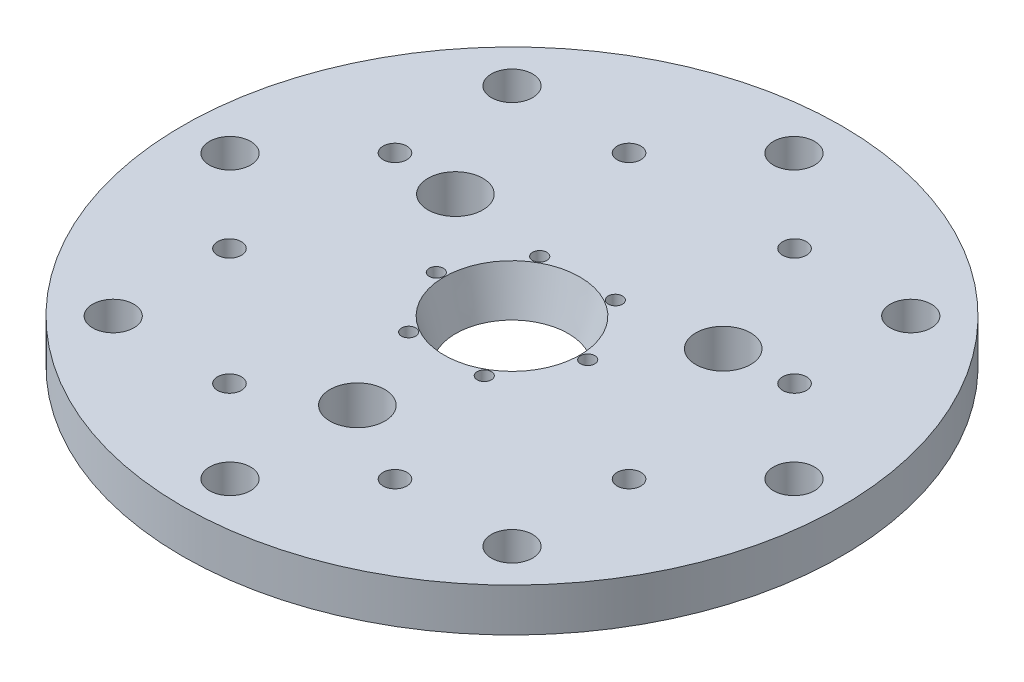
from build123d import *

# Parameters (mm, degrees)
SKETCH1_R                    = 76.2
BOSS_EXTRUDE1_DEPTH          = 10
SKETCH6_R                    = 2.75
CUT_EXTRUDE3_DEPTH           = 109.226059708
CIRPATTERN1_COUNT            = 8
SKETCH7_R                    = 6.35
CUT_EXTRUDE4_DEPTH           = 109.226059708
CIRPATTERN2_COUNT            = 3
F_3_8_0_375_DIAMETER_HOLE1_D = 9.525
CIRPATTERN4_COUNT            = 8
CIRPATTERN5_COUNT            = 6


with BuildPart() as part:
    # Sketch1 → Boss-Extrude1 (new body)
    with BuildSketch(Plane(origin=(0, 0, 0), x_dir=(1, 0, 0), z_dir=(0, 1, 0))):
        with Locations(Location((0, 0, 0), (0, 0, 270))):
            Circle(SKETCH1_R)
    extrude(amount=BOSS_EXTRUDE1_DEPTH)

    # Sketch5 → Cut-Revolve1 (revolve, cut)
    with BuildSketch(Plane.XY, mode=Mode.PRIVATE) as cut_revolve1_sk:
        Polygon((0, 0), (0, 10), (15.679491924, 10), (13, 0), align=None)
    revolve(cut_revolve1_sk.sketch.rotate(Axis((0, 0, 0), (0, 1, 0)), 90), axis=Axis((0, 0, 0), (0, 1, 0)), mode=Mode.SUBTRACT)

    # Sketch6 → Cut-Extrude3 (cut, through all)
    with BuildSketch(Plane(origin=(0, 0, 0), x_dir=(1, 0, 0), z_dir=(0, 1, 0))):
        with Locations(Location((46.193976626, 19.134171618, 0), (0, 0, 270))):
            Circle(SKETCH6_R)
    cut_extrude3 = extrude(amount=CUT_EXTRUDE3_DEPTH, mode=Mode.SUBTRACT)

    # CirPattern1: Cut-Extrude3 ×8 about axis
    cirpattern1_axis = Axis((0, 0, 0), (0, 1, 0))
    for i in range(1, CIRPATTERN1_COUNT):
        add(cut_extrude3.rotate(cirpattern1_axis, i * 360 / CIRPATTERN1_COUNT), mode=Mode.SUBTRACT)

    # Sketch7 → Cut-Extrude4 (cut, through all)
    with BuildSketch(Plane(origin=(0, 10, 0), x_dir=(1, 0, 0), z_dir=(0, 1, 0))):
        with Locations(Location((30.960408185, 17.875, 0), (0, 0, 270))):
            Circle(SKETCH7_R)
    cut_extrude4 = extrude(amount=-CUT_EXTRUDE4_DEPTH, mode=Mode.SUBTRACT)

    # CirPattern2: Cut-Extrude4 ×3 about axis
    cirpattern2_axis = Axis((0, 0, 0), (0, 1, 0))
    for i in range(1, CIRPATTERN2_COUNT):
        add(cut_extrude4.rotate(cirpattern2_axis, i * 360 / CIRPATTERN2_COUNT), mode=Mode.SUBTRACT)

    # 3/8 (0.375) Diameter Hole1 (through all)
    with Locations(Plane(origin=(0, 10, 0), x_dir=(1, 0, 0), z_dir=(0, 1, 0))):
        with Locations((-65.2, 0)):
            f_3_8_0_375_diameter_hole1 = Hole(F_3_8_0_375_DIAMETER_HOLE1_D / 2)

    # CirPattern4: 3/8 (0.375) Diameter Hole1 ×8 about axis
    cirpattern4_axis = Axis((0, 0, 0), (0, 1, 0))
    for i in range(1, CIRPATTERN4_COUNT):
        add(f_3_8_0_375_diameter_hole1.rotate(cirpattern4_axis, i * 360 / CIRPATTERN4_COUNT), mode=Mode.SUBTRACT)

    # Sketch13 → Tap Drill for M4x0.7 Tap1 (revolve, cut)
    with BuildSketch(Plane(origin=(17.5, 10, 0), x_dir=(0, 0, 1), z_dir=(1, 0, 0))):
        Polygon((0, 0), (0, 8.991420021), (1.65, 8), (1.65, 0), align=None)
    tap_drill_for_m4x0_7_tap1 = revolve(axis=Axis((17.5, 16.35, 0), (0, -1, 0)), mode=Mode.SUBTRACT)

    # CirPattern5: Tap Drill for M4x0.7 Tap1 ×6 about axis
    cirpattern5_axis = Axis((0, 0, 0), (0, 1, 0))
    for i in range(1, CIRPATTERN5_COUNT):
        add(tap_drill_for_m4x0_7_tap1.rotate(cirpattern5_axis, i * 360 / CIRPATTERN5_COUNT), mode=Mode.SUBTRACT)


solid = part.part
